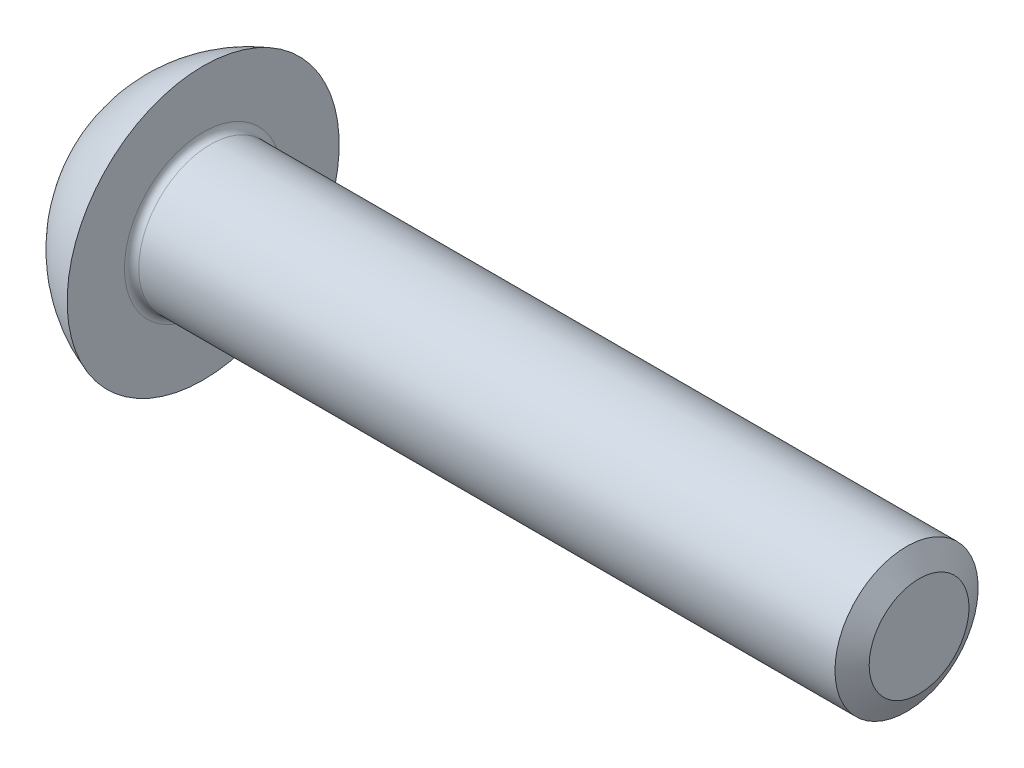
from build123d import *

# Parameters (mm, degrees)
CUT_EXTRUDE_1_DEPTH = 2.2


with BuildPart() as part:
    # 草图1 → 旋转1 (revolve)
    with BuildSketch(Plane.XY):
        with BuildLine():
            Line((0, 2), (-19.8, 2))
            ThreePointArc((-19.8, 2), (-19.941421356, 2.058578644), (-20, 2.2))
            Line((-20, 2.2), (-20, 3.8))
            ThreePointArc((-20, 3.8), (-21.264955669, 3.101612484), (-22.2, 2))
            Line((-22.2, 2), (-22.2, 0))
            Line((-22.2, 0), (0, 0))
            Line((0, 0), (0, 2))
        make_face()
    revolve(axis=Axis((-22.2, 0, 0), (1, 0, 0)))

    # 草图2 → 切除-拉伸1 (cut)
    with BuildSketch(Plane.ZY.offset(22.2)):
        Polygon((0, 1.443375673), (-1.25, 0.721687836), (-1.25, -0.721687836), (0, -1.443375673), (1.25, -0.721687836), (1.25, 0.721687836), align=None)
    extrude(amount=-CUT_EXTRUDE_1_DEPTH, mode=Mode.SUBTRACT)

    # 草图6 → 旋转2 (revolve)
    with BuildSketch(Plane.XY):
        Polygon((-20.9, 1.443375673), (-20, 0), (-19.63, 0), (-19.63, 1.443375673), align=None)
    revolve(axis=Axis((-22.2, 0, 0), (1, 0, 0)))

    # 草图7 → 切除-旋转5 (revolve, cut)
    with BuildSketch(Plane.XY):
        Polygon((-22.2, 1.443375673), (-21.83, 0), (-22.2, 0), align=None)
    revolve(axis=Axis((-22.2, 0, 0), (1, 0, 0)), mode=Mode.SUBTRACT)

    # 草图4 → 切除-旋转1 (revolve, cut)
    with BuildSketch(Plane.XY):
        Polygon((-0.35, 2), (0, 1.393782217), (0.35, 2), align=None)
    revolve(axis=Axis((-0.35, 0, 0), (1, 0, 0)), mode=Mode.SUBTRACT)


solid = part.part
